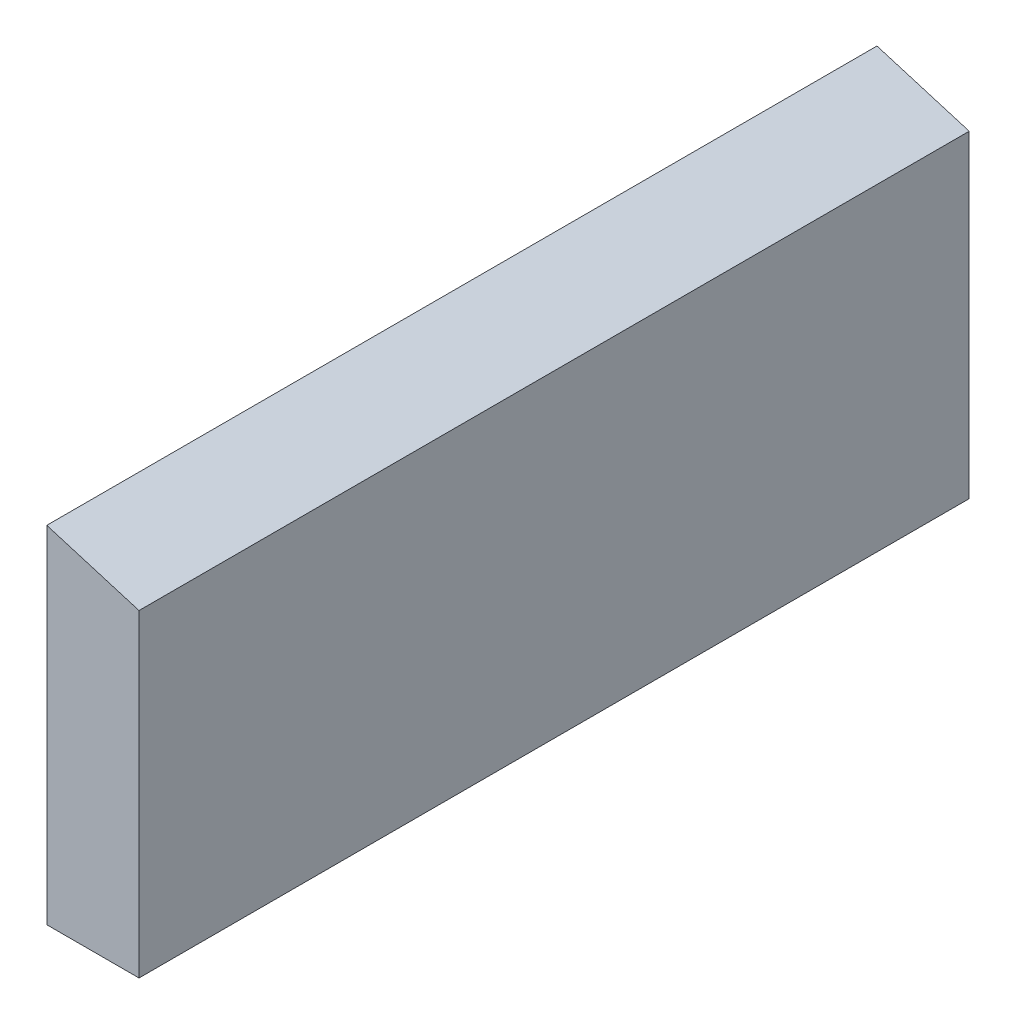
from build123d import *

# Parameters (mm, degrees)
BOSS_EXTRUDE1_DEPTH = 180


with BuildPart() as part:
    # Sketch1 → Boss-Extrude1 (new body)
    with BuildSketch(Plane.XY):
        Polygon((0, 0), (-20, 0), (-20, 75), (0, 69), align=None)
    extrude(amount=BOSS_EXTRUDE1_DEPTH)


solid = part.part
